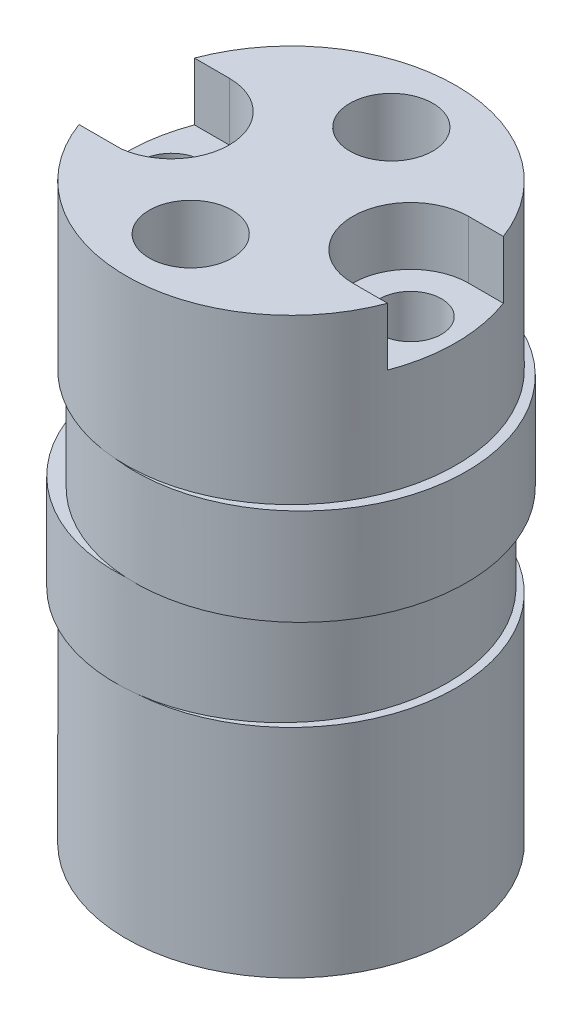
from build123d import *

# Parameters (mm, degrees)
SKETCH1_R            = 8.6
BOSS_EXTRUDE11_DEPTH = 5
SKETCH20_R           = 8.6
BOSS_EXTRUDE12_DEPTH = 5
SKETCH21_R           = 8.55
BOSS_EXTRUDE13_DEPTH = 1
SKETCH22_R           = 8.55
BOSS_EXTRUDE14_DEPTH = 7.5
SKETCH24_R           = 2.15
CUT_EXTRUDE8_DEPTH   = 7
BOSS_EXTRUDE15_START = 11.25
SKETCH30_R           = 8.55
BOSS_EXTRUDE15_DEPTH = 11.25
SKETCH31_R           = 1.6
CUT_EXTRUDE12_DEPTH  = 29.75
SKETCH32_R           = 1.5
CUT_EXTRUDE13_DEPTH  = 22.75
CIRPATTERN7_COUNT    = 2
CIRPATTERN8_COUNT    = 2
SKETCH33_R           = 2.1
CUT_EXTRUDE14_DEPTH  = 5.8
CUT_EXTRUDE15_DEPTH  = 3


with BuildPart() as part:
    # Sketch1 → Boss-Extrude11 (new body)
    with BuildSketch(Plane(origin=(0, 0, 0), x_dir=(1, 0, 0), z_dir=(0, 1, 0))):
        with Locations(Location((0, 0, 0), (0, 0, 270))):
            Circle(SKETCH1_R)
    extrude(amount=BOSS_EXTRUDE11_DEPTH)

    # Sketch20 → Boss-Extrude12 (add)
    with BuildSketch(Plane(origin=(0, 5, 0), x_dir=(1, 0, 0), z_dir=(0, 1, 0))):
        with Locations(Location((1, 0, 0), (0, 0, 93.333029494))):
            Circle(SKETCH20_R)
    extrude(amount=BOSS_EXTRUDE12_DEPTH)

    # Sketch21 → Boss-Extrude13 (add)
    with BuildSketch(Plane(origin=(0, 10, 0), x_dir=(1, 0, 0), z_dir=(0, 1, 0))):
        with Locations(Location((0.5, 0, 0), (0, 0, 94.074449123))):
            Circle(SKETCH21_R)
    extrude(amount=BOSS_EXTRUDE13_DEPTH)

    # Sketch22 → Boss-Extrude14 (add)
    with BuildSketch(Plane(origin=(0, 11, 0), x_dir=(1, 0, 0), z_dir=(0, 1, 0))):
        with Locations(Location((0.5, 0, 0), (0, 0, 94.074449123))):
            Circle(SKETCH22_R)
    extrude(amount=BOSS_EXTRUDE14_DEPTH)

    # Sketch24 → Cut-Extrude8 (cut)
    with BuildSketch(Plane(origin=(0, 18.5, 0), x_dir=(1, 0, 0), z_dir=(0, 1, 0))):
        with Locations(Location((0.7, 5, 0), (0, 0, 270))):
            Circle(SKETCH24_R)
    cut_extrude8 = extrude(amount=-CUT_EXTRUDE8_DEPTH, mode=Mode.SUBTRACT)

    # Sketch30 → Boss-Extrude15 (add)
    with BuildSketch(Plane.XZ.offset(BOSS_EXTRUDE15_START)):
        with Locations(Location((0.5, 0, 0), (0, 0, 265.925550877))):
            Circle(SKETCH30_R)
    extrude(amount=-BOSS_EXTRUDE15_DEPTH)

    # Sketch31 → Cut-Extrude12 (cut)
    with BuildSketch(Plane(origin=(0, 18.5, 0), x_dir=(1, 0, 0), z_dir=(0, 1, 0))):
        with Locations(Location((6.7, 0, 0), (0, 0, 270))):
            Circle(SKETCH31_R)
    cut_extrude12 = extrude(amount=-CUT_EXTRUDE12_DEPTH, mode=Mode.SUBTRACT)

    # Sketch32 → Cut-Extrude13 (cut)
    with BuildSketch(Plane(origin=(0, 11.5, 0), x_dir=(1, 0, 0), z_dir=(0, 1, 0))):
        with Locations(Location((0.7, 5, 0), (0, 0, 270))):
            Circle(SKETCH32_R)
    cut_extrude13 = extrude(amount=-CUT_EXTRUDE13_DEPTH, mode=Mode.SUBTRACT)

    # CirPattern7: Cut-Extrude12 ×2 about axis
    cirpattern7_axis = Axis((0.5, 0, 0), (0, 1, 0))
    for i in range(1, CIRPATTERN7_COUNT):
        add(cut_extrude12.rotate(cirpattern7_axis, i * 360 / CIRPATTERN7_COUNT), mode=Mode.SUBTRACT)

    # CirPattern8: Cut-Extrude8, Cut-Extrude13 ×2 about axis
    cirpattern8_axis = Axis((0.5, 0, 0), (0, 1, 0))
    add([cut_extrude8.rotate(cirpattern8_axis, i * 360 / CIRPATTERN8_COUNT) for i in range(1, CIRPATTERN8_COUNT)], mode=Mode.SUBTRACT)
    add([cut_extrude13.rotate(cirpattern8_axis, i * 360 / CIRPATTERN8_COUNT) for i in range(1, CIRPATTERN8_COUNT)], mode=Mode.SUBTRACT)

    # Sketch33 → Cut-Extrude14 (cut)
    with BuildSketch(Plane.XZ.offset(11.25)):
        with Locations(Location((0.7, 0, 0), (0, 0, 270))):
            Circle(SKETCH33_R)
    extrude(amount=-CUT_EXTRUDE14_DEPTH, mode=Mode.SUBTRACT)

    # Sketch34 → Cut-Extrude15 (cut)
    with BuildSketch(Plane(origin=(0, 18.5, 0), x_dir=(1, 0, 0), z_dir=(0, 1, 0))):
        with BuildLine():
            Line((-5.7, 3), (-9.054437868, 3))
            Line((-9.054437868, 3), (-9.054437868, -2.973683702))
            Line((-9.054437868, -2.973683702), (-5.30350884, -2.973683702))
            ThreePointArc((-5.30350884, -2.973683702), (-2.706586304, 0.198681773), (-5.7, 3))
        make_face()
        with BuildLine():
            Line((6.7, 3), (10.113600604, 3))
            Line((10.113600604, 3), (10.113600604, -3))
            Line((10.113600604, -3), (6.7, -3))
            ThreePointArc((6.7, -3), (3.7, 0), (6.7, 3))
        make_face()
    extrude(amount=-CUT_EXTRUDE15_DEPTH, mode=Mode.SUBTRACT)


solid = part.part
